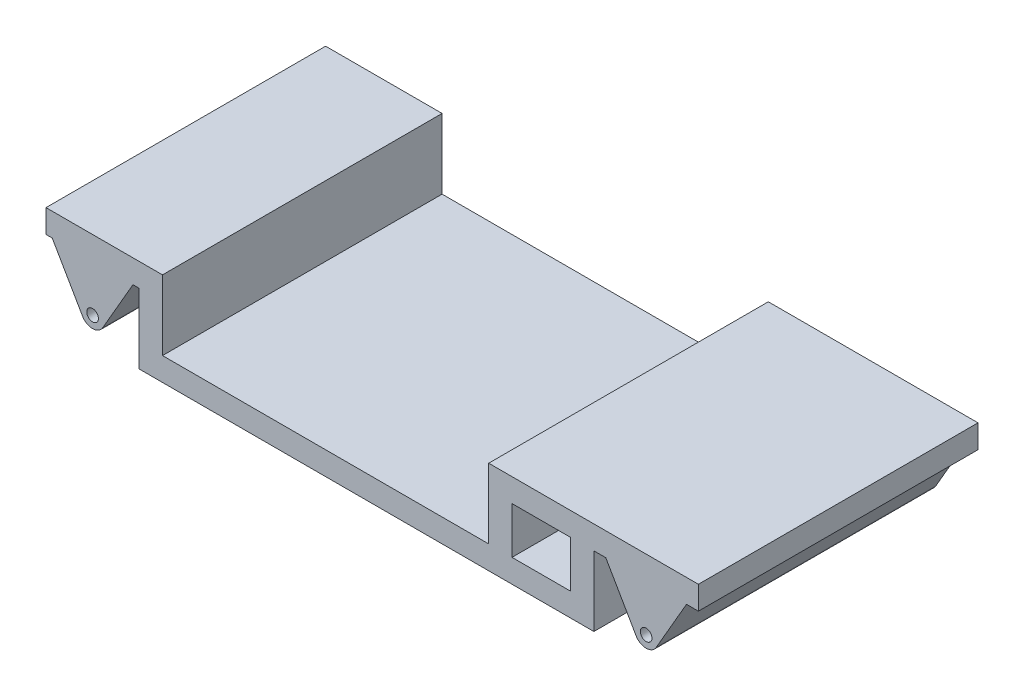
from build123d import *

# Parameters (mm, degrees)
SKETCH4_R           = 25
SKETCH4_W           = 251.424361175
SKETCH4_H           = 200
BOSS_EXTRUDE3_DEPTH = 1200


with BuildPart() as part:
    # Sketch4 → Boss-Extrude3 (new body)
    with BuildSketch(Plane.XY):
        with BuildLine():
            Line((-600, 224.902446896), (1200, 224.902446896))
            Line((1200, 224.902446896), (1351.424361175, 224.902446896))
            Line((1351.424361175, 224.902446896), (1351.424361175, 524.902446896))
            Line((1351.424361175, 524.902446896), (1402.507099831, 524.902446896))
            Line((1402.507099831, 524.902446896), (1532.410910398, 299.902446896))
            ThreePointArc((1532.410910398, 299.902446896), (1575.712180588, 274.902446896), (1619.013450777, 299.902446896))
            Line((1619.013450777, 299.902446896), (1748.917261345, 524.902446896))
            Line((1748.917261345, 524.902446896), (1800, 524.902446896))
            Line((1800, 524.902446896), (1800, 624.902446896))
            Line((1800, 624.902446896), (900, 624.902446896))
            Line((900, 624.902446896), (900, 324.902446896))
            Line((900, 324.902446896), (-500, 324.902446896))
            Line((-500, 324.902446896), (-500, 624.902446896))
            Line((-500, 624.902446896), (-1000, 624.902446896))
            Line((-1000, 624.902446896), (-1000, 524.902446896))
            Line((-1000, 524.902446896), (-973.205080757, 524.902446896))
            Line((-973.205080757, 524.902446896), (-843.301270189, 299.902446896))
            ThreePointArc((-843.301270189, 299.902446896), (-800, 274.902446896), (-756.698729811, 299.902446896))
            Line((-756.698729811, 299.902446896), (-626.794919243, 524.902446896))
            Line((-626.794919243, 524.902446896), (-600, 524.902446896))
            Line((-600, 524.902446896), (-600, 224.902446896))
        make_face()
        with Locations((-800, 324.902446896)):
            Circle(SKETCH4_R, mode=Mode.SUBTRACT)
        with Locations((1575.712180588, 324.902446896)):
            Circle(SKETCH4_R, mode=Mode.SUBTRACT)
        with Locations((1125.712180588, 424.902446896)):
            Rectangle(SKETCH4_W, SKETCH4_H, mode=Mode.SUBTRACT)
    extrude(amount=-BOSS_EXTRUDE3_DEPTH)


solid = part.part
